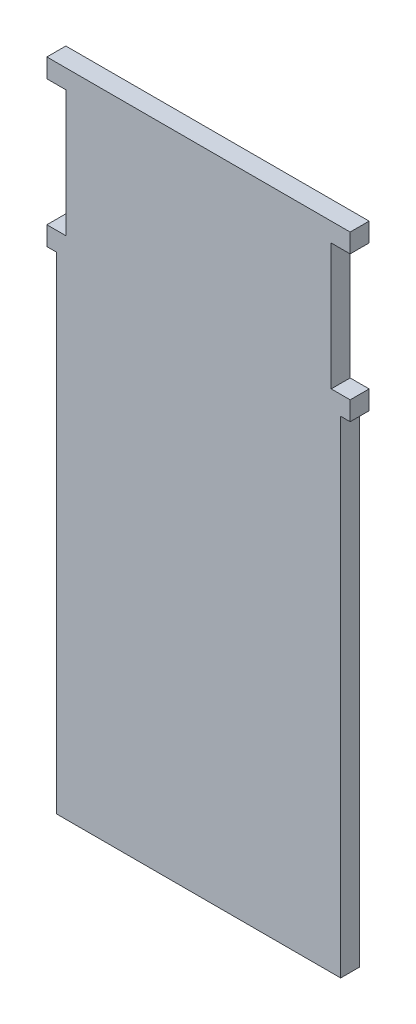
from build123d import *

# Parameters (mm, degrees)
EXTRUSION1_DEPTH = 3


with BuildPart() as part:
    # Esquisse1 → Extrusion1 (new body)
    with BuildSketch(Plane.XY):
        Polygon((-1.5, -26), (0, -26), (0, -23), (-3, -23), (-3, -3), (0, -3), (0, 0), (-48, 0), (-48, -3), (-45, -3), (-45, -23), (-48, -23), (-48, -26), (-46.5, -26), (-46.5, -103), (-1.5, -103), align=None)
    extrude(amount=EXTRUSION1_DEPTH)


solid = part.part
